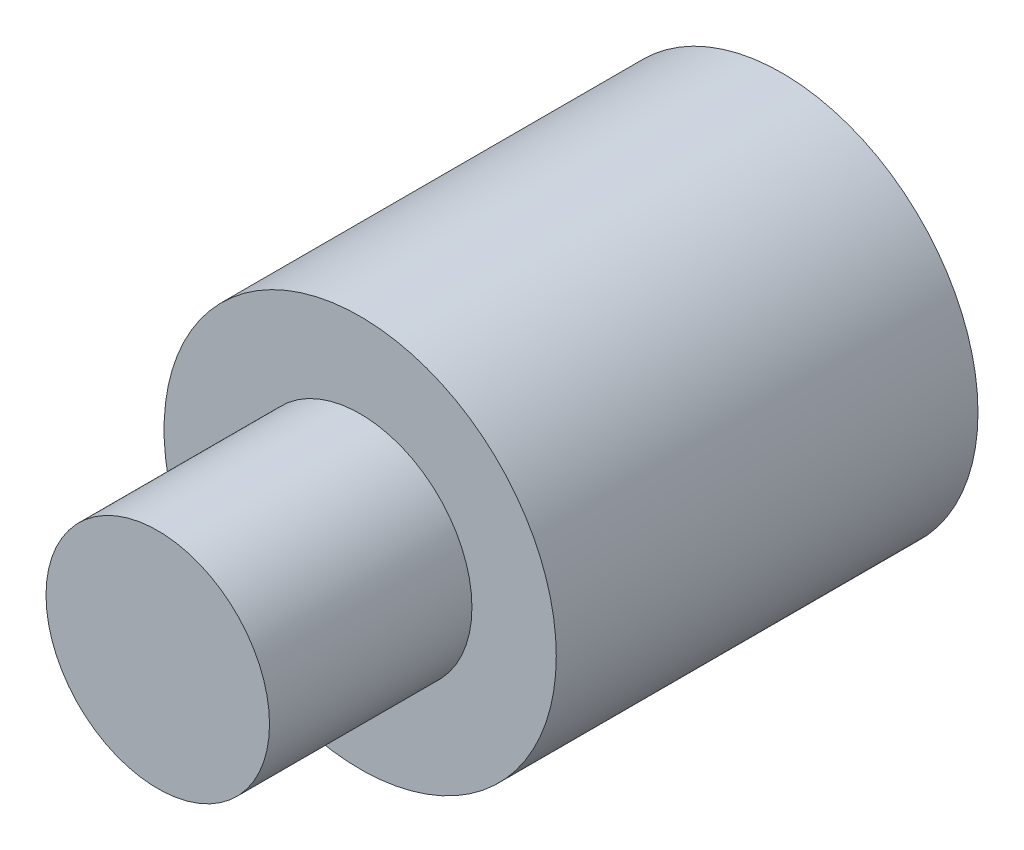
from build123d import *

# Parameters (mm, degrees)
SKETCH1_R           = 4.65
SKETCH1_R_2         = 2.65
BOSS_EXTRUDE1_DEPTH = 9
SKETCH2_R           = 4.65
BOSS_EXTRUDE2_DEPTH = 1
SKETCH3_R           = 2.65
BOSS_EXTRUDE3_DEPTH = 4.8


with BuildPart() as part:
    # Sketch1 → Boss-Extrude1 (new body)
    with BuildSketch(Plane.XY):
        Circle(SKETCH1_R)
        Circle(SKETCH1_R_2, mode=Mode.SUBTRACT)
    extrude(amount=BOSS_EXTRUDE1_DEPTH)

    # Sketch2 → Boss-Extrude2 (add)
    with BuildSketch(Plane.XY.offset(9)):
        Circle(SKETCH2_R)
    extrude(amount=BOSS_EXTRUDE2_DEPTH)

    # Sketch3 → Boss-Extrude3 (add)
    with BuildSketch(Plane.XY.offset(10)):
        Circle(SKETCH3_R)
    extrude(amount=BOSS_EXTRUDE3_DEPTH)


solid = part.part
